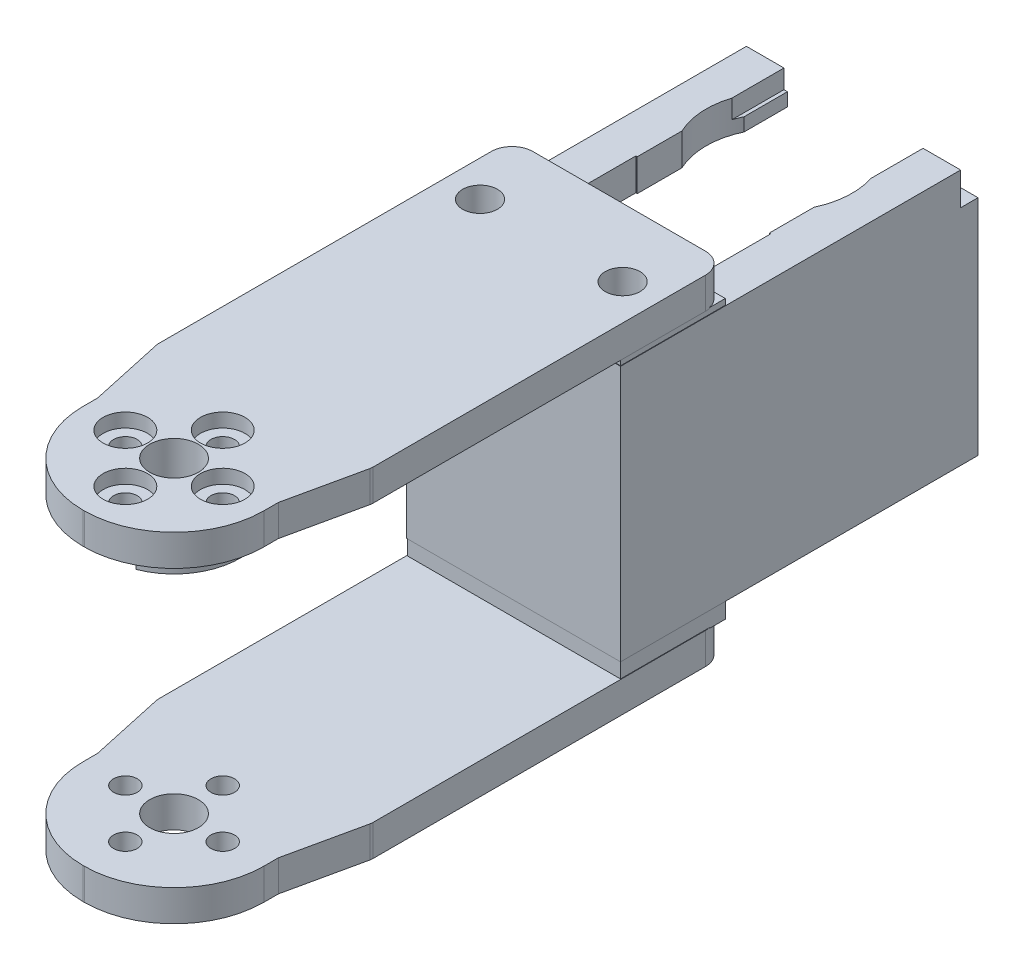
from build123d import *

# Parameters (mm, degrees)
BOSS_1_DEPTH    = 4.5
S_CYL2_R        = 9.5
BOSS_2_DEPTH    = 3.2
BOSS_3_DEPTH    = 4.5
S_BOX4_W        = 30.8
S_BOX4_H        = 36.8
BOSS_4_DEPTH    = 2.5
S_BOX5_W        = 2.5
S_BOX5_H        = 36.8
BOSS_5_DEPTH    = 51.4
S_BOX6_W        = 30.8
S_BOX6_H        = 4.6
BOSS_6_DEPTH    = 51.4
S_BOX7_W        = 2.5
S_BOX7_H        = 36.8
BOSS_7_DEPTH    = 28.2
S_BOX8_W        = 30.66
S_BOX8_H        = 2.4
BOSS_8_DEPTH    = 15.06
S_BOX9_W        = 30.66
S_BOX9_H        = 0.95
BOSS_9_DEPTH    = 15.06
S_HOLE10_R      = 3.5
HOLE_10_DEPTH   = 4.7
S_HOLE11_R      = 1.7
HOLE_11_DEPTH   = 4.7
S_HOLE12_R      = 1.7
HOLE_12_DEPTH   = 4.7
S_HOLE13_R      = 1.7
HOLE_13_DEPTH   = 4.7
S_HOLE14_R      = 1.7
HOLE_14_DEPTH   = 4.7
S_HOLE15_R      = 3.2
HOLE_15_DEPTH   = 1.6
S_HOLE16_R      = 3.2
HOLE_16_DEPTH   = 1.6
S_HOLE17_R      = 3.2
HOLE_17_DEPTH   = 1.6
S_HOLE18_R      = 3.2
HOLE_18_DEPTH   = 1.6
S_HOLE19_R      = 3.5
HOLE_19_DEPTH   = 7.9
S_HOLE20_R      = 1.7
HOLE_20_DEPTH   = 7.9
S_HOLE21_R      = 1.7
HOLE_21_DEPTH   = 7.9
S_HOLE22_R      = 1.7
HOLE_22_DEPTH   = 7.9
S_HOLE23_R      = 1.7
HOLE_23_DEPTH   = 7.9
S_HOLE24_R      = 3.2
HOLE_24_DEPTH   = 2.1
S_HOLE25_R      = 3.2
HOLE_25_DEPTH   = 2.1
S_HOLE26_R      = 3.2
HOLE_26_DEPTH   = 2.1
S_HOLE27_R      = 3.2
HOLE_27_DEPTH   = 2.1
S_CUT28_W       = 6.8
S_CUT28_H       = 1
POCKET_28_DEPTH = 10
S_HOLE29_R      = 10.5
HOLE_29_DEPTH   = 4.8
S_CUT30_W       = 19.4
S_CUT30_H       = 4.75
POCKET_30_DEPTH = 19.5
S_CUT31_W       = 16.4
S_CUT31_H       = 4.75
POCKET_31_DEPTH = 8.3
S_CUT32_W       = 7
S_CUT32_H       = 4.75
POCKET_32_DEPTH = 11
S_CUT33_W       = 20
S_CUT33_H       = 2.9
POCKET_33_DEPTH = 13.7
S_HOLE34_R      = 1.1
HOLE_34_DEPTH   = 4.8
S_HOLE35_R      = 2.3
HOLE_35_DEPTH   = 1.7
S_HOLE36_R      = 1.1
HOLE_36_DEPTH   = 4.8
S_HOLE37_R      = 2.3
HOLE_37_DEPTH   = 1.7
S_CUT38_W       = 31
S_CUT38_H       = 4.8
POCKET_38_DEPTH = 2.6
S_CUT39_W       = 19
S_CUT39_H       = 4.75
POCKET_39_DEPTH = 22.2
S_CUT40_W       = 15
S_CUT40_H       = 1.55
POCKET_40_DEPTH = 27.4
S_HOLE41_R      = 2.5
HOLE_41_DEPTH   = 5.3
S_HOLE42_R      = 2.5
HOLE_42_DEPTH   = 5.3


with BuildPart() as part:
    # S_prism1 → Boss_1 (new body)
    with BuildSketch(Plane(origin=(0, -23.3, 0), x_dir=(1, 0, 0), z_dir=(0, 1, 0))):
        with BuildLine():
            Line((-13, 2), (-15.354, 12.7893))
            ThreePointArc((-15.354, 12.7893), (-15.38850097, 13.001208985), (-15.4, 13.2156))
            Line((-15.4, 13.2156), (-15.4, 61))
            ThreePointArc((-15.4, 61), (-14.5213, 63.1213), (-12.4, 64))
            Line((-12.4, 64), (12.4, 64))
            ThreePointArc((12.4, 64), (14.5213, 63.1213), (15.4, 61))
            Line((15.4, 61), (15.4, 13.2156))
            ThreePointArc((15.4, 13.2156), (15.38850097, 13.001208985), (15.354, 12.7893))
            Line((15.354, 12.7893), (13, 2))
            Line((13, 2), (13, -0.1))
            ThreePointArc((13, -0.1), (9.2217, -9.2217), (0.1, -13))
            Line((0.1, -13), (-0.1, -13))
            ThreePointArc((-0.1, -13), (-9.2217, -9.2217), (-13, -0.1))
            Line((-13, -0.1), (-13, 2))
        make_face()
    extrude(amount=BOSS_1_DEPTH)



with BuildPart() as body_2:
    # S_cyl2 → Boss_2 (new body)
    with BuildSketch(Plane(origin=(0, 17.75, 0), x_dir=(1, 0, 0), z_dir=(0, 1, 0))):
        with Locations(Location((0, 0, 0), (0, 0, 270))):
            Circle(S_CYL2_R)
    extrude(amount=BOSS_2_DEPTH)

    # S_prism3 → Boss_3 (add)
    with BuildSketch(Plane(origin=(0, 20.95, 0), x_dir=(1, 0, 0), z_dir=(0, 1, 0))):
        with BuildLine():
            Line((-13, 2), (-15.354, 12.7893))
            ThreePointArc((-15.354, 12.7893), (-15.38850097, 13.001208985), (-15.4, 13.2156))
            Line((-15.4, 13.2156), (-15.4, 61))
            ThreePointArc((-15.4, 61), (-14.5213, 63.1213), (-12.4, 64))
            Line((-12.4, 64), (12.4, 64))
            ThreePointArc((12.4, 64), (14.5213, 63.1213), (15.4, 61))
            Line((15.4, 61), (15.4, 13.2156))
            ThreePointArc((15.4, 13.2156), (15.38850097, 13.001208985), (15.354, 12.7893))
            Line((15.354, 12.7893), (13, 2))
            Line((13, 2), (13, -0.1))
            ThreePointArc((13, -0.1), (9.2217, -9.2217), (0.1, -13))
            Line((0.1, -13), (-0.1, -13))
            ThreePointArc((-0.1, -13), (-9.2217, -9.2217), (-13, -0.1))
            Line((-13, -0.1), (-13, 2))
        make_face()
    extrude(amount=BOSS_3_DEPTH)


with BuildPart() as body_3:
    # S_box4 → Boss_4 (new body)
    with BuildSketch(Plane.XY.offset(-51.3)):
        with Locations((0, 1.8)):
            Rectangle(S_BOX4_W, S_BOX4_H)
    extrude(amount=BOSS_4_DEPTH)

    # S_box5 → Boss_5 (add)
    with BuildSketch(Plane.XY.offset(-100.2)):
        with Locations((14.15, 1.8)):
            Rectangle(S_BOX5_W, S_BOX5_H)
    extrude(amount=BOSS_5_DEPTH)

    # S_box6 → Boss_6 (add)
    with BuildSketch(Plane.XY.offset(-100.2)):
        with Locations((0, 17.9)):
            Rectangle(S_BOX6_W, S_BOX6_H)
    extrude(amount=BOSS_6_DEPTH)

    # S_box7 → Boss_7 (add)
    with BuildSketch(Plane.XY.offset(-77)):
        with Locations((-14.15, 1.8)):
            Rectangle(S_BOX7_W, S_BOX7_H)
    extrude(amount=BOSS_7_DEPTH)


with BuildPart() as part_1:
    add(part.part)

    add(body_3.part)  # Boss_8 merges body 3
    # S_box8 → Boss_8 (add)
    with BuildSketch(Plane.XY.offset(-63.93)):
        with Locations((0, -17.7)):
            Rectangle(S_BOX8_W, S_BOX8_H)
    extrude(amount=BOSS_8_DEPTH)


    add(body_2.part)  # Boss_9 merges body 2
    # S_box9 → Boss_9 (add)
    with BuildSketch(Plane.XY.offset(-63.93)):
        with Locations((0, 20.575)):
            Rectangle(S_BOX9_W, S_BOX9_H)
    extrude(amount=BOSS_9_DEPTH)

    # S_hole10 → Hole_10 (cut)
    with BuildSketch(Plane(origin=(0, -23.4, 0), x_dir=(1, 0, 0), z_dir=(0, 1, 0))):
        with Locations(Location((0, 0, 0), (0, 0, 90))):
            Circle(S_HOLE10_R)
    extrude(amount=HOLE_10_DEPTH, mode=Mode.SUBTRACT)

    # S_hole11 → Hole_11 (cut)
    with BuildSketch(Plane(origin=(0, -23.4, 0), x_dir=(1, 0, 0), z_dir=(0, 1, 0))):
        with Locations(Location((7, 0, 0), (0, 0, 90))):
            Circle(S_HOLE11_R)
    extrude(amount=HOLE_11_DEPTH, mode=Mode.SUBTRACT)

    # S_hole12 → Hole_12 (cut)
    with BuildSketch(Plane(origin=(0, -23.4, 0), x_dir=(1, 0, 0), z_dir=(0, 1, 0))):
        with Locations(Location((0, -7, 0), (0, 0, 90))):
            Circle(S_HOLE12_R)
    extrude(amount=HOLE_12_DEPTH, mode=Mode.SUBTRACT)

    # S_hole13 → Hole_13 (cut)
    with BuildSketch(Plane(origin=(0, -23.4, 0), x_dir=(1, 0, 0), z_dir=(0, 1, 0))):
        with Locations(Location((-7, 0, 0), (0, 0, 90))):
            Circle(S_HOLE13_R)
    extrude(amount=HOLE_13_DEPTH, mode=Mode.SUBTRACT)

    # S_hole14 → Hole_14 (cut)
    with BuildSketch(Plane(origin=(0, -23.4, 0), x_dir=(1, 0, 0), z_dir=(0, 1, 0))):
        with Locations(Location((0, 7, 0), (0, 0, 90))):
            Circle(S_HOLE14_R)
    extrude(amount=HOLE_14_DEPTH, mode=Mode.SUBTRACT)

    # S_hole15 → Hole_15 (cut)
    with BuildSketch(Plane(origin=(0, -23.4, 0), x_dir=(1, 0, 0), z_dir=(0, 1, 0))):
        with Locations(Location((7, 0, 0), (0, 0, 90))):
            Circle(S_HOLE15_R)
    extrude(amount=HOLE_15_DEPTH, mode=Mode.SUBTRACT)

    # S_hole16 → Hole_16 (cut)
    with BuildSketch(Plane(origin=(0, -23.4, 0), x_dir=(1, 0, 0), z_dir=(0, 1, 0))):
        with Locations(Location((0, -7, 0), (0, 0, 90))):
            Circle(S_HOLE16_R)
    extrude(amount=HOLE_16_DEPTH, mode=Mode.SUBTRACT)

    # S_hole17 → Hole_17 (cut)
    with BuildSketch(Plane(origin=(0, -23.4, 0), x_dir=(1, 0, 0), z_dir=(0, 1, 0))):
        with Locations(Location((-7, 0, 0), (0, 0, 90))):
            Circle(S_HOLE17_R)
    extrude(amount=HOLE_17_DEPTH, mode=Mode.SUBTRACT)

    # S_hole18 → Hole_18 (cut)
    with BuildSketch(Plane(origin=(0, -23.4, 0), x_dir=(1, 0, 0), z_dir=(0, 1, 0))):
        with Locations(Location((0, 7, 0), (0, 0, 90))):
            Circle(S_HOLE18_R)
    extrude(amount=HOLE_18_DEPTH, mode=Mode.SUBTRACT)

    # S_hole19 → Hole_19 (cut)
    with BuildSketch(Plane(origin=(0, 17.65, 0), x_dir=(1, 0, 0), z_dir=(0, 1, 0))):
        with Locations(Location((0, 0, 0), (0, 0, 90))):
            Circle(S_HOLE19_R)
    extrude(amount=HOLE_19_DEPTH, mode=Mode.SUBTRACT)

    # S_hole20 → Hole_20 (cut)
    with BuildSketch(Plane(origin=(0, 17.65, 0), x_dir=(1, 0, 0), z_dir=(0, 1, 0))):
        with Locations(Location((7, 0, 0), (0, 0, 90))):
            Circle(S_HOLE20_R)
    extrude(amount=HOLE_20_DEPTH, mode=Mode.SUBTRACT)

    # S_hole21 → Hole_21 (cut)
    with BuildSketch(Plane(origin=(0, 17.65, 0), x_dir=(1, 0, 0), z_dir=(0, 1, 0))):
        with Locations(Location((0, -7, 0), (0, 0, 90))):
            Circle(S_HOLE21_R)
    extrude(amount=HOLE_21_DEPTH, mode=Mode.SUBTRACT)

    # S_hole22 → Hole_22 (cut)
    with BuildSketch(Plane(origin=(0, 17.65, 0), x_dir=(1, 0, 0), z_dir=(0, 1, 0))):
        with Locations(Location((-7, 0, 0), (0, 0, 90))):
            Circle(S_HOLE22_R)
    extrude(amount=HOLE_22_DEPTH, mode=Mode.SUBTRACT)

    # S_hole23 → Hole_23 (cut)
    with BuildSketch(Plane(origin=(0, 17.65, 0), x_dir=(1, 0, 0), z_dir=(0, 1, 0))):
        with Locations(Location((0, 7, 0), (0, 0, 90))):
            Circle(S_HOLE23_R)
    extrude(amount=HOLE_23_DEPTH, mode=Mode.SUBTRACT)

    # S_hole24 → Hole_24 (cut)
    with BuildSketch(Plane(origin=(0, 23.45, 0), x_dir=(1, 0, 0), z_dir=(0, 1, 0))):
        with Locations(Location((7, 0, 0), (0, 0, 90))):
            Circle(S_HOLE24_R)
    extrude(amount=HOLE_24_DEPTH, mode=Mode.SUBTRACT)

    # S_hole25 → Hole_25 (cut)
    with BuildSketch(Plane(origin=(0, 23.45, 0), x_dir=(1, 0, 0), z_dir=(0, 1, 0))):
        with Locations(Location((0, -7, 0), (0, 0, 90))):
            Circle(S_HOLE25_R)
    extrude(amount=HOLE_25_DEPTH, mode=Mode.SUBTRACT)

    # S_hole26 → Hole_26 (cut)
    with BuildSketch(Plane(origin=(0, 23.45, 0), x_dir=(1, 0, 0), z_dir=(0, 1, 0))):
        with Locations(Location((-7, 0, 0), (0, 0, 90))):
            Circle(S_HOLE26_R)
    extrude(amount=HOLE_26_DEPTH, mode=Mode.SUBTRACT)

    # S_hole27 → Hole_27 (cut)
    with BuildSketch(Plane(origin=(0, 23.45, 0), x_dir=(1, 0, 0), z_dir=(0, 1, 0))):
        with Locations(Location((0, 7, 0), (0, 0, 90))):
            Circle(S_HOLE27_R)
    extrude(amount=HOLE_27_DEPTH, mode=Mode.SUBTRACT)

    # S_cut28 → Pocket_28 (cut)
    with BuildSketch(Plane.XY):
        with Locations((0, 18.15)):
            Rectangle(S_CUT28_W, S_CUT28_H)
    extrude(amount=POCKET_28_DEPTH, mode=Mode.SUBTRACT)

    # S_hole29 → Hole_29 (cut)
    with BuildSketch(Plane(origin=(0, 15.5, 0), x_dir=(1, 0, 0), z_dir=(0, 1, 0))):
        with Locations(Location((0, 87, 0), (0, 0, 90))):
            Circle(S_HOLE29_R)
    extrude(amount=HOLE_29_DEPTH, mode=Mode.SUBTRACT)

    # S_cut30 → Pocket_30 (cut)
    with BuildSketch(Plane.XY.offset(-76.1)):
        with Locations((0, 17.925)):
            Rectangle(S_CUT30_W, S_CUT30_H)
    extrude(amount=POCKET_30_DEPTH, mode=Mode.SUBTRACT)

    # S_cut31 → Pocket_31 (cut)
    with BuildSketch(Plane.XY.offset(-56.6)):
        with Locations((0, 17.925)):
            Rectangle(S_CUT31_W, S_CUT31_H)
    extrude(amount=POCKET_31_DEPTH, mode=Mode.SUBTRACT)

    # S_cut32 → Pocket_32 (cut)
    with BuildSketch(Plane.XY.offset(-87)):
        with Locations((0, 17.925)):
            Rectangle(S_CUT32_W, S_CUT32_H)
    extrude(amount=POCKET_32_DEPTH, mode=Mode.SUBTRACT)

    # S_cut33 → Pocket_33 (cut)
    with BuildSketch(Plane.XY.offset(-100.7)):
        with Locations((0, 18.95)):
            Rectangle(S_CUT33_W, S_CUT33_H)
    extrude(amount=POCKET_33_DEPTH, mode=Mode.SUBTRACT)

    # S_hole34 → Hole_34 (cut)
    with BuildSketch(Plane(origin=(0, 15.5, 0), x_dir=(1, 0, 0), z_dir=(0, 1, 0))):
        with Locations(Location((-10.25, 54.25, 0), (0, 0, 270))):
            Circle(S_HOLE34_R)
    extrude(amount=HOLE_34_DEPTH, mode=Mode.SUBTRACT)

    # S_hole35 → Hole_35 (cut)
    with BuildSketch(Plane(origin=(0, 18.6, 0), x_dir=(1, 0, 0), z_dir=(0, 1, 0))):
        with Locations((-10.25, 54.25)):
            Circle(S_HOLE35_R)
    extrude(amount=HOLE_35_DEPTH, mode=Mode.SUBTRACT)

    # S_hole36 → Hole_36 (cut)
    with BuildSketch(Plane(origin=(0, 15.5, 0), x_dir=(1, 0, 0), z_dir=(0, 1, 0))):
        with Locations(Location((10.25, 54.25, 0), (0, 0, 270))):
            Circle(S_HOLE36_R)
    extrude(amount=HOLE_36_DEPTH, mode=Mode.SUBTRACT)

    # S_hole37 → Hole_37 (cut)
    with BuildSketch(Plane(origin=(0, 18.6, 0), x_dir=(1, 0, 0), z_dir=(0, 1, 0))):
        with Locations((10.25, 54.25)):
            Circle(S_HOLE37_R)
    extrude(amount=HOLE_37_DEPTH, mode=Mode.SUBTRACT)

    # S_cut38 → Pocket_38 (cut)
    with BuildSketch(Plane.XY.offset(-100.3)):
        with Locations((0, 17.9)):
            Rectangle(S_CUT38_W, S_CUT38_H)
    extrude(amount=POCKET_38_DEPTH, mode=Mode.SUBTRACT)

    # S_cut39 → Pocket_39 (cut)
    with BuildSketch(Plane.XY.offset(-97.8)):
        with Locations((0, 17.925)):
            Rectangle(S_CUT39_W, S_CUT39_H)
    extrude(amount=POCKET_39_DEPTH, mode=Mode.SUBTRACT)

    # S_cut40 → Pocket_40 (cut)
    with BuildSketch(Plane.XY.offset(-78.9)):
        with Locations((0, -16.975)):
            Rectangle(S_CUT40_W, S_CUT40_H)
    extrude(amount=POCKET_40_DEPTH, mode=Mode.SUBTRACT)

    # S_hole41 → Hole_41 (cut)
    with BuildSketch(Plane(origin=(0, 20.25, 0), x_dir=(1, 0, 0), z_dir=(0, 1, 0))):
        with Locations(Location((-10.25, 54.25, 0), (0, 0, 90))):
            Circle(S_HOLE41_R)
    extrude(amount=HOLE_41_DEPTH, mode=Mode.SUBTRACT)

    # S_hole42 → Hole_42 (cut)
    with BuildSketch(Plane(origin=(0, 20.25, 0), x_dir=(1, 0, 0), z_dir=(0, 1, 0))):
        with Locations(Location((10.25, 54.25, 0), (0, 0, 90))):
            Circle(S_HOLE42_R)
    extrude(amount=HOLE_42_DEPTH, mode=Mode.SUBTRACT)


solid = part_1.part
